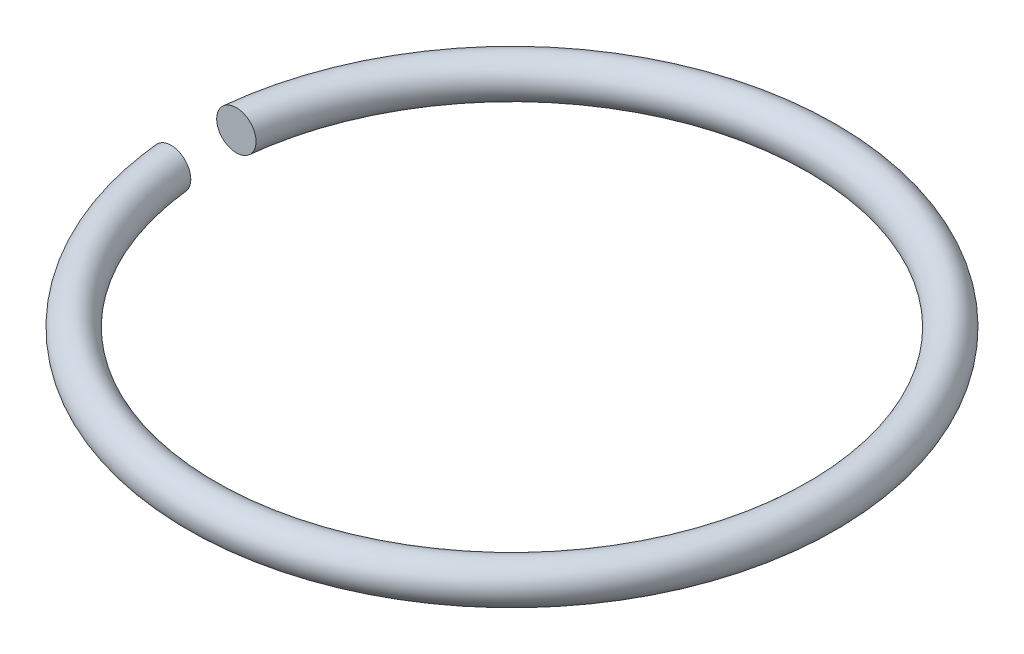
from build123d import *

# Parameters (mm, degrees)
SKETCH_1_R               = 0.6
CUT_EXTRUDE_1_DEPTH      = 15.333876108
CUT_EXTRUDE_1_DEPTH_BACK = 15.333876108
SKETCH_2_W               = 4.994748993
SKETCH_2_H               = 2


with BuildPart() as part:
    # Эскиз1 → Повернуть1 (revolve)
    with BuildSketch(Plane.XY, mode=Mode.PRIVATE) as revolve_1_sk:
        with Locations((-9.5, 0.6)):
            Circle(SKETCH_1_R)
    revolve(revolve_1_sk.sketch.rotate(Axis((0, 0, 0), (0, 1, 0)), 270), axis=Axis((0, 0, 0), (0, 1, 0)))

    # Эскиз2 → Вырез-Вытянуть1 (cut, two sides: drawn at the far end of the back side and taken through both)
    with BuildSketch(Plane(origin=(0, 0, 0), x_dir=(1, 0, 0), z_dir=(0, 1, 0)).offset(-CUT_EXTRUDE_1_DEPTH_BACK)):
        with Locations((-9.664623001, 0)):
            Rectangle(SKETCH_2_W, SKETCH_2_H)
    extrude(amount=CUT_EXTRUDE_1_DEPTH + CUT_EXTRUDE_1_DEPTH_BACK, mode=Mode.SUBTRACT)


solid = part.part
